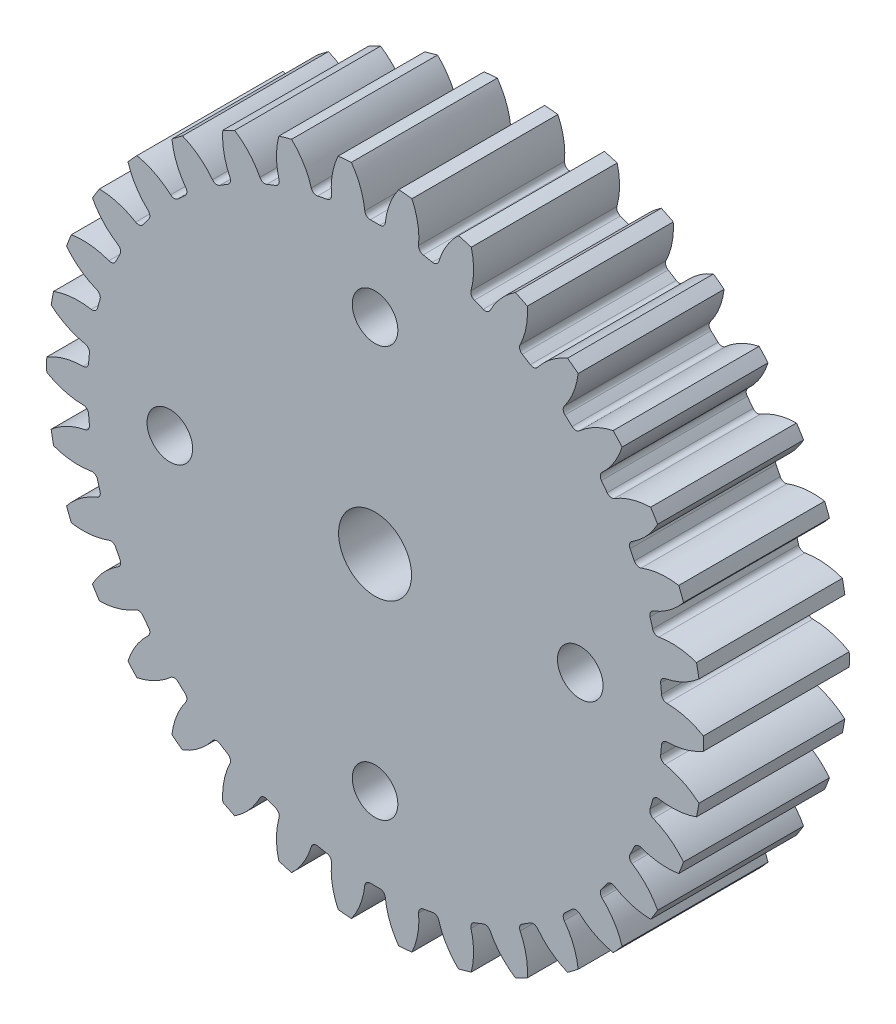
from build123d import *

# Parameters (mm, degrees)
IZIM1_R                        = 36
Y_KSEKLIK_EKSTR_ZYON1_DEPTH    = 8
KES_EKSTR_ZYON1_DEPTH          = 16
RADYUS1_R                      = 0.6
DAIRESEL_KAPLAMA1_COUNT        = 34
RADYUS1_OF_DAIRESEL_KAPLAMA1_R = 0.6
SKETCH1_R                      = 4
CUT_EXTRUDE1_DEPTH             = 54.303515936
SKETCH2_R                      = 2.5
CUT_EXTRUDE2_DEPTH             = 54.303515936


with BuildPart() as part:
    # Çizim1 → Yükseklik-Ekstrüzyon1 (new, symmetric)
    with BuildSketch(Plane.XY):
        Circle(IZIM1_R)
    extrude(amount=Y_KSEKLIK_EKSTR_ZYON1_DEPTH, both=True)

    # Çizim2 → Kes-Ekstrüzyon1 (cut)
    with BuildSketch(Plane.XY.offset(8)):
        with BuildLine():
            ThreePointArc((-3.382543143, 36.845059396), (-1.733935189, 34.377607641), (-1.088142285, 31.481199888))
            ThreePointArc((-1.088142285, 31.481199888), (0, 31.5), (1.088142285, 31.481199888))
            ThreePointArc((1.088142285, 31.481199888), (1.733935189, 34.377607641), (3.382543143, 36.845059396))
            ThreePointArc((3.382543143, 36.845059396), (0, 37), (-3.382543143, 36.845059396))
        make_face()
    kes_ekstr_zyon1 = extrude(amount=-KES_EKSTR_ZYON1_DEPTH, mode=Mode.SUBTRACT)

    # Radyus1
    radyus1_edges = [part.edges().sort_by_distance(p)[0] for p in [
        (-1.088142285, 31.481199888, 0),
        (1.088142285, 31.481199888, 0),
    ]]
    fillet(radyus1_edges, radius=RADYUS1_R)

    # Dairesel Kaplama1: Kes-Ekstrüzyon1 ×34 about axis
    dairesel_kaplama1_axis = Axis((0, 0, 0), (0, 0, 1))
    for i in range(1, DAIRESEL_KAPLAMA1_COUNT):
        add(kes_ekstr_zyon1.rotate(dairesel_kaplama1_axis, i * 360 / DAIRESEL_KAPLAMA1_COUNT), mode=Mode.SUBTRACT)

    # Radyus1 of Dairesel Kaplama1
    radyus1_of_dairesel_kaplama1_edges = [part.edges().sort_by_distance(p)[0] for p in [
        (-6.854269894, 30.745227015, 0),
        (-4.715040705, 31.145118256, 0),
        (-12.386983563, 28.962262312, 0),
        (-10.357658639, 29.748426976, 0),
        (-17.497873364, 26.193022501, 0),
        (-15.64755893, 27.338688694, 0),
        (-22.012894073, 22.531810725, 0),
        (-20.404600369, 23.997964159, 0),
        (-25.778292076, 18.103305158, 0),
        (-24.466787616, 19.840017736, 0),
        (-28.66584126, 13.058313247, 0),
        (-27.695787754, 15.006443305, 0),
        (-30.577209601, 7.568636139, 0),
        (-29.981641059, 9.661842445, 0),
        (-31.447307742, 1.821218206, 0),
        (-31.246505535, 3.988219129, 0),
        (-31.246505535, -3.988219129, 0),
        (-31.447307742, -1.821218206, 0),
        (-29.981641059, -9.661842445, 0),
        (-30.577209601, -7.568636139, 0),
        (-27.695787754, -15.006443305, 0),
        (-28.66584126, -13.058313247, 0),
        (-24.466787616, -19.840017736, 0),
        (-25.778292076, -18.103305158, 0),
        (-20.404600369, -23.997964159, 0),
        (-22.012894073, -22.531810725, 0),
        (-15.64755893, -27.338688694, 0),
        (-17.497873364, -26.193022501, 0),
        (-10.357658639, -29.748426976, 0),
        (-12.386983563, -28.962262312, 0),
        (-4.715040705, -31.145118256, 0),
        (-6.854269894, -30.745227015, 0),
        (1.088142285, -31.481199888, 0),
        (-1.088142285, -31.481199888, 0),
        (6.854269894, -30.745227015, 0),
        (4.715040705, -31.145118256, 0),
        (12.386983563, -28.962262312, 0),
        (10.357658639, -29.748426976, 0),
        (17.497873364, -26.193022501, 0),
        (15.64755893, -27.338688694, 0),
        (22.012894073, -22.531810725, 0),
        (20.404600369, -23.997964159, 0),
        (25.778292076, -18.103305158, 0),
        (24.466787616, -19.840017736, 0),
        (28.66584126, -13.058313247, 0),
        (27.695787754, -15.006443305, 0),
        (30.577209601, -7.568636139, 0),
        (29.981641059, -9.661842445, 0),
        (31.447307742, -1.821218206, 0),
        (31.246505535, -3.988219129, 0),
        (31.246505535, 3.988219129, 0),
        (31.447307742, 1.821218206, 0),
        (29.981641059, 9.661842445, 0),
        (30.577209601, 7.568636139, 0),
        (27.695787754, 15.006443305, 0),
        (28.66584126, 13.058313247, 0),
        (24.466787616, 19.840017736, 0),
        (25.778292076, 18.103305158, 0),
        (20.404600369, 23.997964159, 0),
        (22.012894073, 22.531810725, 0),
        (15.64755893, 27.338688694, 0),
        (17.497873364, 26.193022501, 0),
        (10.357658639, 29.748426976, 0),
        (12.386983563, 28.962262312, 0),
        (4.715040705, 31.145118256, 0),
        (6.854269894, 30.745227015, 0),
    ]]
    fillet(radyus1_of_dairesel_kaplama1_edges, radius=RADYUS1_OF_DAIRESEL_KAPLAMA1_R)

    # Sketch1 → Cut-Extrude1 (cut, through all)
    with BuildSketch(Plane.XY.offset(8)):
        Circle(SKETCH1_R)
    extrude(amount=-CUT_EXTRUDE1_DEPTH, mode=Mode.SUBTRACT)

    # Sketch2 → Cut-Extrude2 (cut, through all)
    with BuildSketch(Plane.XY.offset(8)):
        with Locations((0, 22.5)):
            Circle(SKETCH2_R)
        with Locations((-22.5, 0)):
            Circle(SKETCH2_R)
        with Locations((22.5, 0)):
            Circle(SKETCH2_R)
        with Locations((0, -22.5)):
            Circle(SKETCH2_R)
    extrude(amount=-CUT_EXTRUDE2_DEPTH, mode=Mode.SUBTRACT)


solid = part.part
